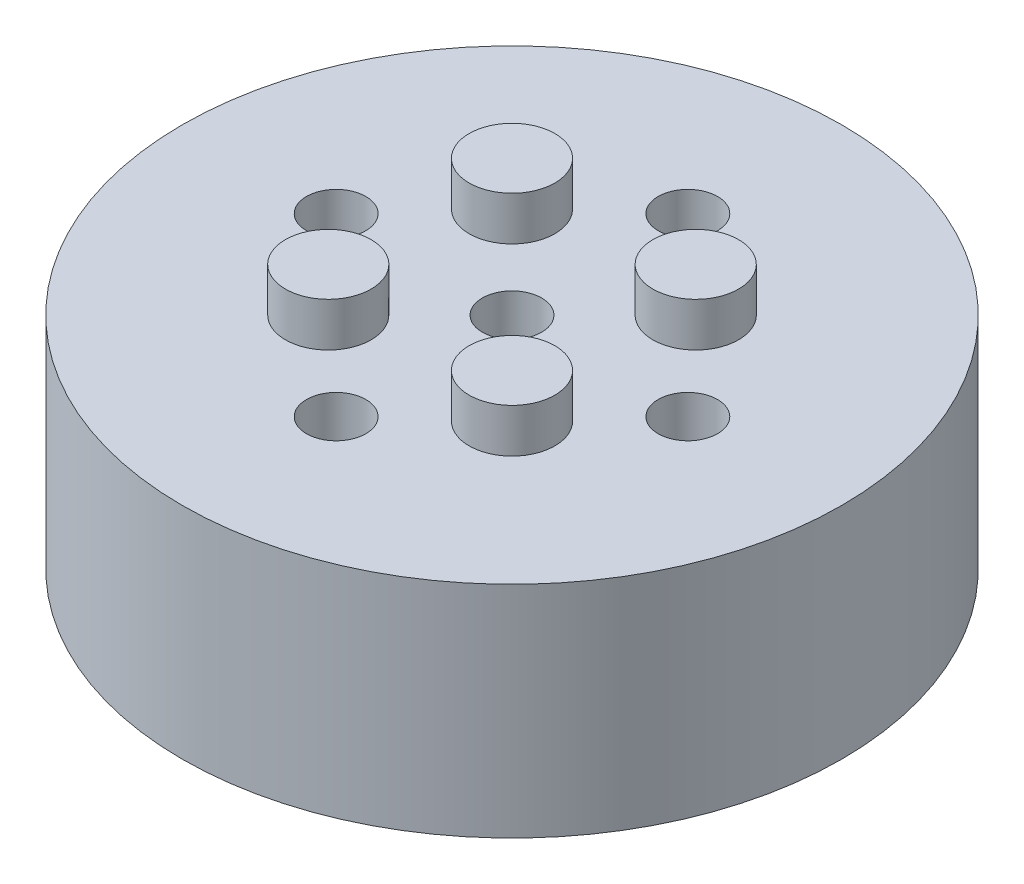
from build123d import *

# Parameters (mm, degrees)
SKETCH1_R           = 15
BOSS_EXTRUDE1_DEPTH = 10
SKETCH2_R           = 1.95
BOSS_EXTRUDE2_DEPTH = 2
CUT_EXTRUDE1_DEPTH  = 2
SKETCH4_R           = 1.35
CUT_EXTRUDE2_DEPTH  = 24.452078799
CIRPATTERN2_COUNT   = 4
CIRPATTERN3_COUNT   = 4
SKETCH5_R           = 3
CUT_EXTRUDE3_DEPTH  = 5
SKETCH6_R           = 1.35
CUT_EXTRUDE4_DEPTH  = 23.338307904


with BuildPart() as part:
    # Sketch1 → Boss-Extrude1 (new body)
    with BuildSketch(Plane(origin=(0, 0, 0), x_dir=(1, 0, 0), z_dir=(0, 1, 0))):
        Circle(SKETCH1_R)
    extrude(amount=BOSS_EXTRUDE1_DEPTH)

    # Sketch2 → Boss-Extrude2 (add)
    with BuildSketch(Plane(origin=(0, 10, 0), x_dir=(1, 0, 0), z_dir=(0, 1, 0))):
        with Locations((4.179388408, 4.179388408)):
            Circle(SKETCH2_R)
    boss_extrude2 = extrude(amount=BOSS_EXTRUDE2_DEPTH)

    # Sketch3 → Cut-Extrude1 (cut)
    with BuildSketch(Plane.XZ):
        Polygon((-2.05, 10.5), (2.05, 10.5), (2.05, 2), (10.55, 2), (10.55, -2.1), (2.05, -2.1), (2.05, -10.6), (-2.05, -10.6), (-2.05, -2.1), (-10.55, -2.1), (-10.55, 2), (-2.05, 2), align=None)
    extrude(amount=-CUT_EXTRUDE1_DEPTH, mode=Mode.SUBTRACT)

    # Sketch4 → Cut-Extrude2 (cut, through all)
    with BuildSketch(Plane.XZ.offset(-2)):
        with Locations((0, 8)):
            Circle(SKETCH4_R)
    cut_extrude2 = extrude(amount=-CUT_EXTRUDE2_DEPTH, mode=Mode.SUBTRACT)

    # CirPattern2: Cut-Extrude2 ×4 about axis
    cirpattern2_axis = Axis((0, 0, 0), (0, 1, 0))
    for i in range(1, CIRPATTERN2_COUNT):
        add(cut_extrude2.rotate(cirpattern2_axis, i * 360 / CIRPATTERN2_COUNT), mode=Mode.SUBTRACT)

    # CirPattern3: Boss-Extrude2 ×4 about axis
    cirpattern3_axis = Axis((0, 10, 0), (0, 1, 0))
    for i in range(1, CIRPATTERN3_COUNT):
        add(boss_extrude2.rotate(cirpattern3_axis, i * 360 / CIRPATTERN3_COUNT))

    # Sketch5 → Cut-Extrude3 (cut)
    with BuildSketch(Plane.XZ.offset(-2)):
        Circle(SKETCH5_R)
    extrude(amount=-CUT_EXTRUDE3_DEPTH, mode=Mode.SUBTRACT)

    # Sketch6 → Cut-Extrude4 (cut, through all)
    with BuildSketch(Plane.XZ.offset(-7)):
        Circle(SKETCH6_R)
    extrude(amount=-CUT_EXTRUDE4_DEPTH, mode=Mode.SUBTRACT)


solid = part.part
